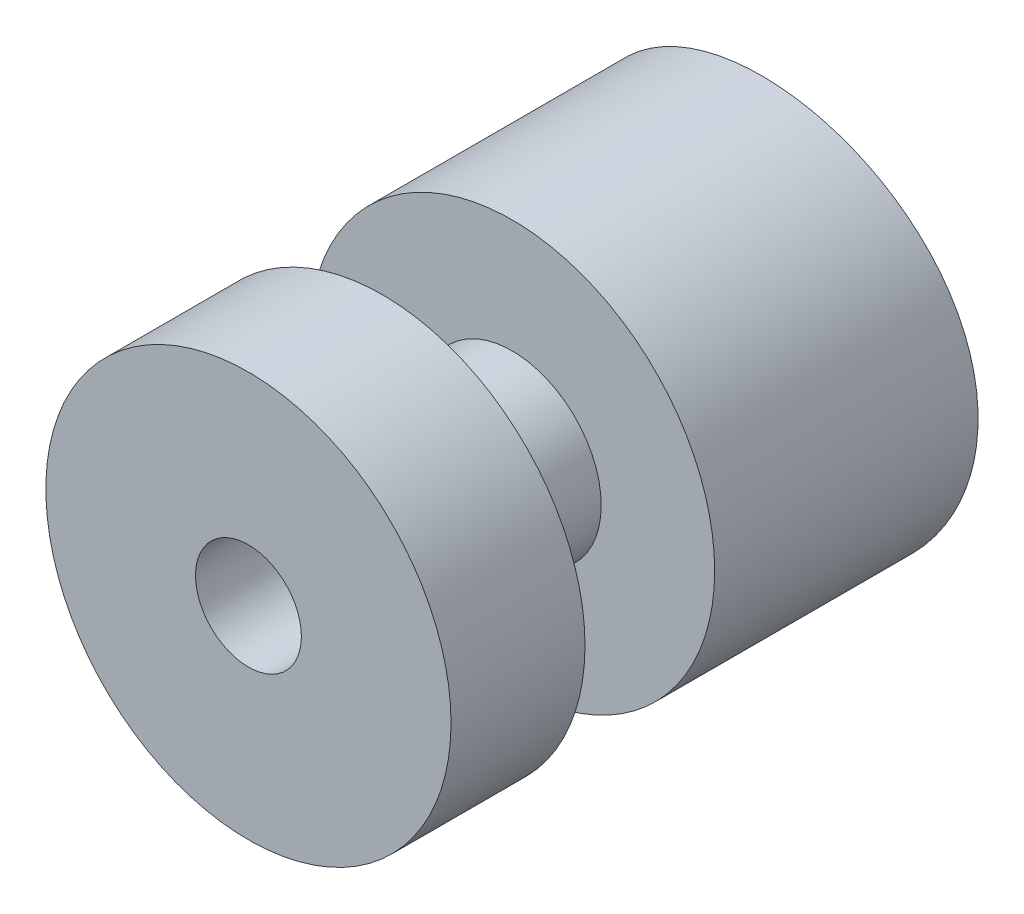
from build123d import *

# Parameters (mm, degrees)
SKETCH1_R              = 9.525
EXTRUDE1_DEPTH         = 24.78278
SKETCH2_OUTSIDE_W      = 28.372
SKETCH2_OUTSIDE_H      = 28.372
SKETCH2_OUTSIDE_R      = 4.191
EXTRUDE2_DEPTH         = 6.096
EXTRUDE3_DEPTH         = 29.207045831
EXTRUDE3_DEPTH_BACK    = 29.207045831
F_10_CLEARANCE_HOLE1_D = 4.9784


with BuildPart() as part:
    # Sketch1 → Extrude1 (new body)
    with BuildSketch(Plane.XY):
        Circle(SKETCH1_R)
    extrude(amount=EXTRUDE1_DEPTH)

    # Sketch2 outside → Extrude2 (cut)
    with BuildSketch(Plane.XY.offset(18.48358)):
        Rectangle(SKETCH2_OUTSIDE_W, SKETCH2_OUTSIDE_H)
        Circle(SKETCH2_OUTSIDE_R, mode=Mode.SUBTRACT)
    extrude(amount=-EXTRUDE2_DEPTH, mode=Mode.SUBTRACT)

    # Sketch3 → Extrude3 (cut, two sides: drawn at the far end of the back side and taken through both)
    with BuildSketch(Plane(origin=(0, 0, 0), x_dir=(1, 0, 0), z_dir=(0, 1, 0)).offset(-EXTRUDE3_DEPTH_BACK)):
        with BuildLine():
            Line((81.364445057, 9.888659405), (9.525, 0))
            ThreePointArc((9.525, 0), (0, -0.652479271), (-9.525, 0))
            Line((-9.525, 0), (-81.364445057, 9.888659405))
            Line((-81.364445057, 9.888659405), (-81.364445057, 154.92233068))
            Line((-81.364445057, 154.92233068), (81.364445057, 154.92233068))
            Line((81.364445057, 154.92233068), (81.364445057, 9.888659405))
        make_face()
    extrude(amount=EXTRUDE3_DEPTH + EXTRUDE3_DEPTH_BACK, mode=Mode.SUBTRACT)

    # #10 Clearance Hole1 (through all)
    with Locations(Plane.XY.offset(24.78278)):
        with Locations((0, 0)):
            Hole(F_10_CLEARANCE_HOLE1_D / 2)


solid = part.part
